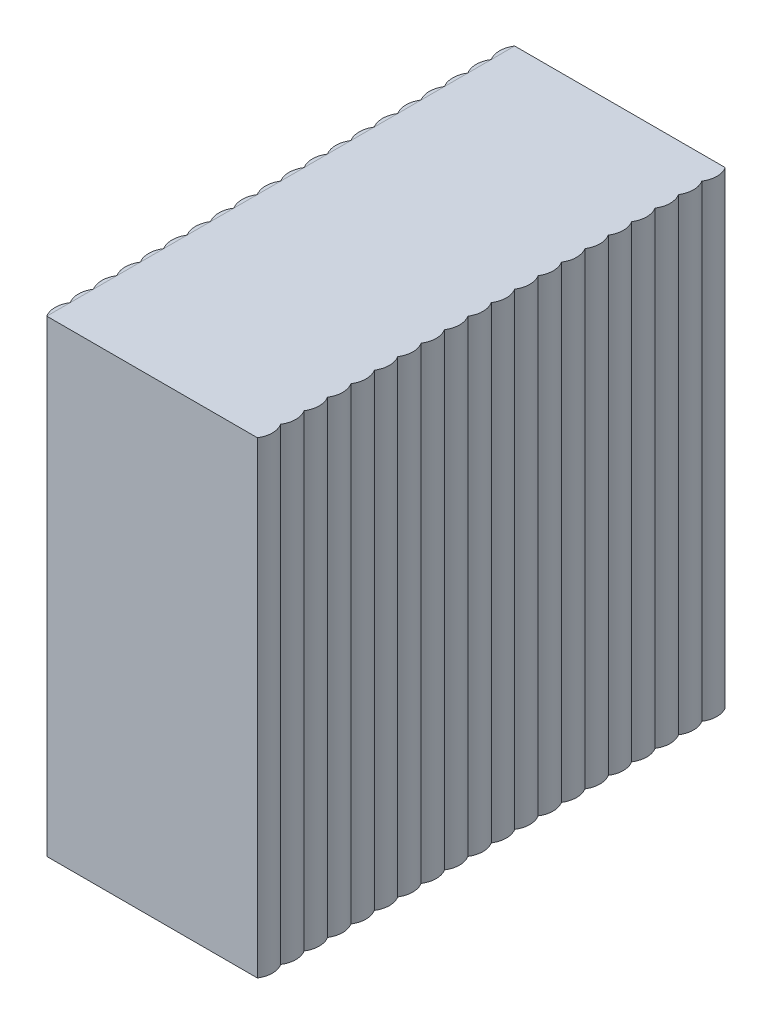
from build123d import *

# Parameters (mm, degrees)
SKETCH_1_W         = 5
SKETCH_1_H         = 5
EXTRUDE_1_DEPTH    = 2.25
EXTRUDE_3_DEPTH    = 5
EXTRUDE_3_2_DEPTH  = 5
EXTRUDE_3_3_DEPTH  = 5
EXTRUDE_3_4_DEPTH  = 5
EXTRUDE_3_5_DEPTH  = 5
EXTRUDE_3_6_DEPTH  = 5
EXTRUDE_3_7_DEPTH  = 5
EXTRUDE_3_8_DEPTH  = 5
EXTRUDE_3_9_DEPTH  = 5
EXTRUDE_3_10_DEPTH = 5
EXTRUDE_3_11_DEPTH = 5
EXTRUDE_3_12_DEPTH = 5
EXTRUDE_3_13_DEPTH = 5
EXTRUDE_3_14_DEPTH = 5
EXTRUDE_3_15_DEPTH = 5
EXTRUDE_3_16_DEPTH = 5
EXTRUDE_3_17_DEPTH = 5
EXTRUDE_3_18_DEPTH = 5
EXTRUDE_3_19_DEPTH = 5
EXTRUDE_3_20_DEPTH = 5


with BuildPart() as part:
    # 草图1 → 凸台-拉伸1 (new body)
    with BuildSketch(Plane(origin=(0, 0, 0), x_dir=(0, 0, -1), z_dir=(1, 0, 0))):
        with Locations((2.5, 2.5)):
            Rectangle(SKETCH_1_W, SKETCH_1_H)
    extrude(amount=EXTRUDE_1_DEPTH)


with BuildPart() as body_2:
    # 草图3 → 凸台-拉伸3 (new body)
    with BuildSketch(Plane.XZ):
        with BuildLine():
            ThreePointArc((0, -4.75), (-0.03635585, -4.875), (0, -5))
            Line((0, -5), (0, -4.75))
        make_face()
    extrude_3 = extrude(amount=-EXTRUDE_3_DEPTH)


with BuildPart() as body_3:
    # 草图3 → Extrude 3 2 (new body)
    with BuildSketch(Plane.XZ):
        with BuildLine():
            ThreePointArc((0, -4.5), (-0.03635585, -4.625), (0, -4.75))
            Line((0, -4.75), (0, -4.5))
        make_face()
    extrude_3_2 = extrude(amount=-EXTRUDE_3_2_DEPTH)


with BuildPart() as body_4:
    # 草图3 → Extrude 3 3 (new body)
    with BuildSketch(Plane.XZ):
        with BuildLine():
            ThreePointArc((0, -4.25), (-0.03635585, -4.375), (0, -4.5))
            Line((0, -4.5), (0, -4.25))
        make_face()
    extrude_3_3 = extrude(amount=-EXTRUDE_3_3_DEPTH)


with BuildPart() as body_5:
    # 草图3 → Extrude 3 4 (new body)
    with BuildSketch(Plane.XZ):
        with BuildLine():
            ThreePointArc((0, -4), (-0.03635585, -4.125), (0, -4.25))
            Line((0, -4.25), (0, -4))
        make_face()
    extrude_3_4 = extrude(amount=-EXTRUDE_3_4_DEPTH)


with BuildPart() as body_6:
    # 草图3 → Extrude 3 5 (new body)
    with BuildSketch(Plane.XZ):
        with BuildLine():
            ThreePointArc((0, -3.75), (-0.03635585, -3.875), (0, -4))
            Line((0, -4), (0, -3.75))
        make_face()
    extrude_3_5 = extrude(amount=-EXTRUDE_3_5_DEPTH)


with BuildPart() as body_7:
    # 草图3 → Extrude 3 6 (new body)
    with BuildSketch(Plane.XZ):
        with BuildLine():
            ThreePointArc((0, -3.5), (-0.03635585, -3.625), (0, -3.75))
            Line((0, -3.75), (0, -3.5))
        make_face()
    extrude_3_6 = extrude(amount=-EXTRUDE_3_6_DEPTH)


with BuildPart() as body_8:
    # 草图3 → Extrude 3 7 (new body)
    with BuildSketch(Plane.XZ):
        with BuildLine():
            ThreePointArc((0, -3.25), (-0.03635585, -3.375), (0, -3.5))
            Line((0, -3.5), (0, -3.25))
        make_face()
    extrude_3_7 = extrude(amount=-EXTRUDE_3_7_DEPTH)


with BuildPart() as body_9:
    # 草图3 → Extrude 3 8 (new body)
    with BuildSketch(Plane.XZ):
        with BuildLine():
            ThreePointArc((0, -3), (-0.03635585, -3.125), (0, -3.25))
            Line((0, -3.25), (0, -3))
        make_face()
    extrude_3_8 = extrude(amount=-EXTRUDE_3_8_DEPTH)


with BuildPart() as body_10:
    # 草图3 → Extrude 3 9 (new body)
    with BuildSketch(Plane.XZ):
        with BuildLine():
            ThreePointArc((0, -2.75), (-0.03635585, -2.875), (0, -3))
            Line((0, -3), (0, -2.75))
        make_face()
    extrude_3_9 = extrude(amount=-EXTRUDE_3_9_DEPTH)


with BuildPart() as body_11:
    # 草图3 → Extrude 3 10 (new body)
    with BuildSketch(Plane.XZ):
        with BuildLine():
            ThreePointArc((0, -2.5), (-0.03635585, -2.625), (0, -2.75))
            Line((0, -2.75), (0, -2.5))
        make_face()
    extrude_3_10 = extrude(amount=-EXTRUDE_3_10_DEPTH)


with BuildPart() as body_12:
    # 草图3 → Extrude 3 11 (new body)
    with BuildSketch(Plane.XZ):
        with BuildLine():
            ThreePointArc((0, -2.25), (-0.03635585, -2.375), (0, -2.5))
            Line((0, -2.5), (0, -2.25))
        make_face()
    extrude_3_11 = extrude(amount=-EXTRUDE_3_11_DEPTH)


with BuildPart() as body_13:
    # 草图3 → Extrude 3 12 (new body)
    with BuildSketch(Plane.XZ):
        with BuildLine():
            ThreePointArc((0, -2), (-0.03635585, -2.125), (0, -2.25))
            Line((0, -2.25), (0, -2))
        make_face()
    extrude_3_12 = extrude(amount=-EXTRUDE_3_12_DEPTH)


with BuildPart() as body_14:
    # 草图3 → Extrude 3 13 (new body)
    with BuildSketch(Plane.XZ):
        with BuildLine():
            ThreePointArc((0, -1.75), (-0.03635585, -1.875), (0, -2))
            Line((0, -2), (0, -1.75))
        make_face()
    extrude_3_13 = extrude(amount=-EXTRUDE_3_13_DEPTH)


with BuildPart() as body_15:
    # 草图3 → Extrude 3 14 (new body)
    with BuildSketch(Plane.XZ):
        with BuildLine():
            ThreePointArc((0, -1.5), (-0.03635585, -1.625), (0, -1.75))
            Line((0, -1.75), (0, -1.5))
        make_face()
    extrude_3_14 = extrude(amount=-EXTRUDE_3_14_DEPTH)


with BuildPart() as body_16:
    # 草图3 → Extrude 3 15 (new body)
    with BuildSketch(Plane.XZ):
        with BuildLine():
            ThreePointArc((0, -1.25), (-0.03635585, -1.375), (0, -1.5))
            Line((0, -1.5), (0, -1.25))
        make_face()
    extrude_3_15 = extrude(amount=-EXTRUDE_3_15_DEPTH)


with BuildPart() as body_17:
    # 草图3 → Extrude 3 16 (new body)
    with BuildSketch(Plane.XZ):
        with BuildLine():
            ThreePointArc((0, -1), (-0.03635585, -1.125), (0, -1.25))
            Line((0, -1.25), (0, -1))
        make_face()
    extrude_3_16 = extrude(amount=-EXTRUDE_3_16_DEPTH)


with BuildPart() as body_18:
    # 草图3 → Extrude 3 17 (new body)
    with BuildSketch(Plane.XZ):
        with BuildLine():
            ThreePointArc((0, -0.75), (-0.03635585, -0.875), (0, -1))
            Line((0, -1), (0, -0.75))
        make_face()
    extrude_3_17 = extrude(amount=-EXTRUDE_3_17_DEPTH)


with BuildPart() as body_19:
    # 草图3 → Extrude 3 18 (new body)
    with BuildSketch(Plane.XZ):
        with BuildLine():
            ThreePointArc((0, -0.5), (-0.03635585, -0.625), (0, -0.75))
            Line((0, -0.75), (0, -0.5))
        make_face()
    extrude_3_18 = extrude(amount=-EXTRUDE_3_18_DEPTH)


with BuildPart() as body_20:
    # 草图3 → Extrude 3 19 (new body)
    with BuildSketch(Plane.XZ):
        with BuildLine():
            ThreePointArc((0, -0.25), (-0.03635585, -0.375), (0, -0.5))
            Line((0, -0.5), (0, -0.25))
        make_face()
    extrude_3_19 = extrude(amount=-EXTRUDE_3_19_DEPTH)


with BuildPart() as body_21:
    # 草图3 → Extrude 3 20 (new body)
    with BuildSketch(Plane.XZ):
        with BuildLine():
            ThreePointArc((0, 0), (-0.03635585, -0.125), (0, -0.25))
            Line((0, -0.25), (0, 0))
        make_face()
    extrude_3_20 = extrude(amount=-EXTRUDE_3_20_DEPTH)


with BuildPart() as part_1:
    add(part.part)

    # 镜向1: 凸台-拉伸3, Extrude 3 2, Extrude 3 3, Extrude 3 4, Extrude 3 5, Extrude 3 6, Extrude 3 7, Extrude 3 8, Extrude 3 9, Extrude 3 10, Extrude 3 11, Extrude 3 12, Extrude 3 13, Extrude 3 14, Extrude 3 15, Extrude 3 16, Extrude 3 17, Extrude 3 18, Extrude 3 19, Extrude 3 20 across plane
    add(extrude_3.mirror(Plane(origin=(1.125, 0, 0), x_dir=(0, 0, 1), z_dir=(1, 0, 0))))
    add(extrude_3_2.mirror(Plane(origin=(1.125, 0, 0), x_dir=(0, 0, 1), z_dir=(1, 0, 0))))
    add(extrude_3_3.mirror(Plane(origin=(1.125, 0, 0), x_dir=(0, 0, 1), z_dir=(1, 0, 0))))
    add(extrude_3_4.mirror(Plane(origin=(1.125, 0, 0), x_dir=(0, 0, 1), z_dir=(1, 0, 0))))
    add(extrude_3_5.mirror(Plane(origin=(1.125, 0, 0), x_dir=(0, 0, 1), z_dir=(1, 0, 0))))
    add(extrude_3_6.mirror(Plane(origin=(1.125, 0, 0), x_dir=(0, 0, 1), z_dir=(1, 0, 0))))
    add(extrude_3_7.mirror(Plane(origin=(1.125, 0, 0), x_dir=(0, 0, 1), z_dir=(1, 0, 0))))
    add(extrude_3_8.mirror(Plane(origin=(1.125, 0, 0), x_dir=(0, 0, 1), z_dir=(1, 0, 0))))
    add(extrude_3_9.mirror(Plane(origin=(1.125, 0, 0), x_dir=(0, 0, 1), z_dir=(1, 0, 0))))
    add(extrude_3_10.mirror(Plane(origin=(1.125, 0, 0), x_dir=(0, 0, 1), z_dir=(1, 0, 0))))
    add(extrude_3_11.mirror(Plane(origin=(1.125, 0, 0), x_dir=(0, 0, 1), z_dir=(1, 0, 0))))
    add(extrude_3_12.mirror(Plane(origin=(1.125, 0, 0), x_dir=(0, 0, 1), z_dir=(1, 0, 0))))
    add(extrude_3_13.mirror(Plane(origin=(1.125, 0, 0), x_dir=(0, 0, 1), z_dir=(1, 0, 0))))
    add(extrude_3_14.mirror(Plane(origin=(1.125, 0, 0), x_dir=(0, 0, 1), z_dir=(1, 0, 0))))
    add(extrude_3_15.mirror(Plane(origin=(1.125, 0, 0), x_dir=(0, 0, 1), z_dir=(1, 0, 0))))
    add(extrude_3_16.mirror(Plane(origin=(1.125, 0, 0), x_dir=(0, 0, 1), z_dir=(1, 0, 0))))
    add(extrude_3_17.mirror(Plane(origin=(1.125, 0, 0), x_dir=(0, 0, 1), z_dir=(1, 0, 0))))
    add(extrude_3_18.mirror(Plane(origin=(1.125, 0, 0), x_dir=(0, 0, 1), z_dir=(1, 0, 0))))
    add(extrude_3_19.mirror(Plane(origin=(1.125, 0, 0), x_dir=(0, 0, 1), z_dir=(1, 0, 0))))
    add(extrude_3_20.mirror(Plane(origin=(1.125, 0, 0), x_dir=(0, 0, 1), z_dir=(1, 0, 0))))


solid = Compound([body_2.part, body_3.part, body_4.part, body_5.part, body_6.part, body_7.part, body_8.part, body_9.part, body_10.part, body_11.part, body_12.part, body_13.part, body_14.part, body_15.part, body_16.part, body_17.part, body_18.part, body_19.part, body_20.part, body_21.part, part_1.part])
